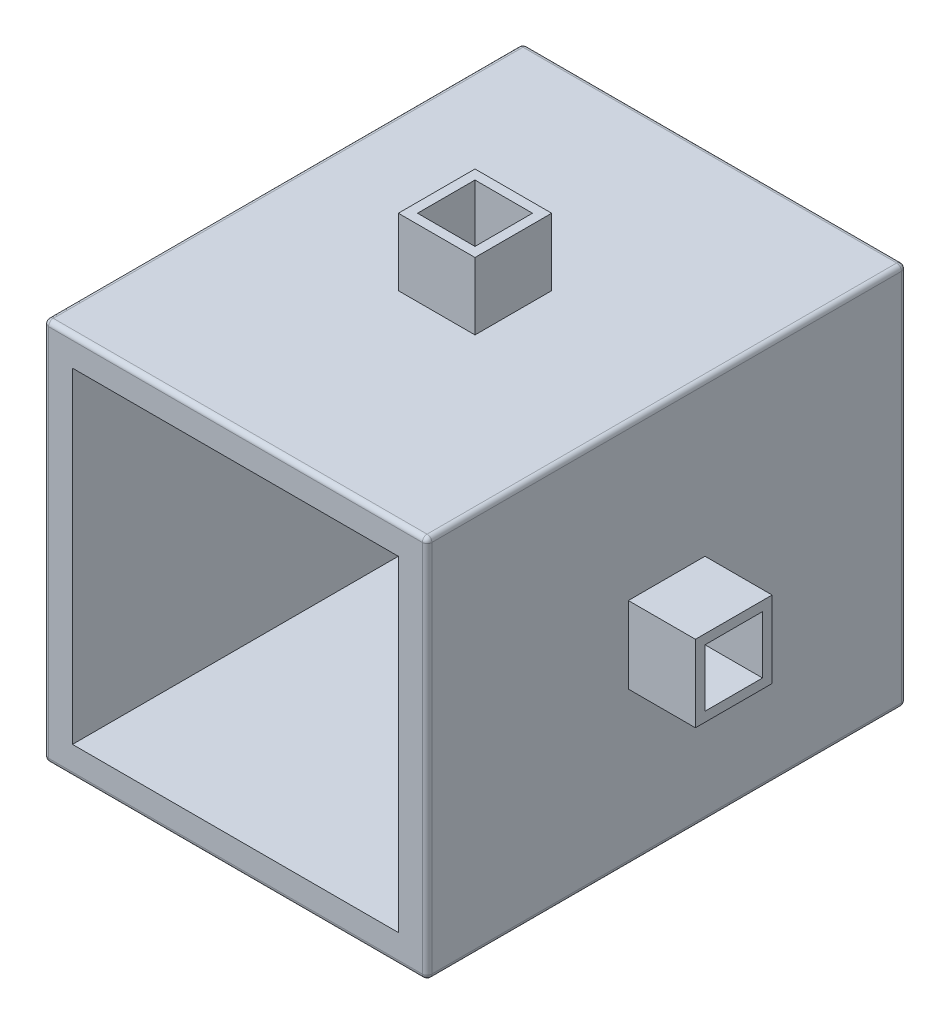
from build123d import *

# Parameters (mm, degrees)
SKETCH1_W           = 101.6
SKETCH1_H           = 101.6
BOSS_EXTRUDE1_DEPTH = 127
SKETCH2_W           = 86.36
SKETCH2_H           = 86.36
CUT_EXTRUDE1_DEPTH  = 116.84
SKETCH4_W           = 20.32
SKETCH4_H           = 20.32
SKETCH4_W_2         = 15.24
SKETCH4_H_2         = 15.24
BOSS_EXTRUDE2_DEPTH = 17.78
SKETCH6_R           = 7.62
CUT_EXTRUDE2_DEPTH  = 1.27
SKETCH7_W           = 20.32
SKETCH7_H           = 20.32
SKETCH7_W_2         = 15.24
SKETCH7_H_2         = 15.24
BOSS_EXTRUDE3_DEPTH = 17.78
SKETCH9_R           = 7.62
CUT_EXTRUDE3_DEPTH  = 1.27
FILLET1_R           = 1.27


with BuildPart() as part:
    # Sketch1 → Boss-Extrude1 (new body)
    with BuildSketch(Plane.XY):
        Rectangle(SKETCH1_W, SKETCH1_H)
    extrude(amount=BOSS_EXTRUDE1_DEPTH)

    # Sketch2 → Cut-Extrude1 (cut)
    with BuildSketch(Plane.XY.offset(127)):
        Rectangle(SKETCH2_W, SKETCH2_H)
    extrude(amount=-CUT_EXTRUDE1_DEPTH, mode=Mode.SUBTRACT)

    # Sketch4 → Boss-Extrude2 (add)
    with BuildSketch(Plane(origin=(0, 50.8, 0), x_dir=(1, 0, 0), z_dir=(0, 1, 0))):
        with Locations((0, -63.5)):
            Rectangle(SKETCH4_W, SKETCH4_H)
        with Locations((0, -63.5)):
            Rectangle(SKETCH4_W_2, SKETCH4_H_2, mode=Mode.SUBTRACT)
    boss_extrude2 = extrude(amount=BOSS_EXTRUDE2_DEPTH)

    # Sketch6 → Cut-Extrude2 (cut)
    with BuildSketch(Plane(origin=(0, 50.8, 0), x_dir=(1, 0, 0), z_dir=(0, 1, 0))):
        with Locations(Location((0, -63.5, 0), (0, 0, 180))):
            Circle(SKETCH6_R)
    cut_extrude2 = extrude(amount=-CUT_EXTRUDE2_DEPTH, mode=Mode.SUBTRACT)

    # Mirror1: Boss-Extrude2, Cut-Extrude2 across plane
    add(boss_extrude2.mirror(Plane.ZX))
    add(cut_extrude2.mirror(Plane.ZX), mode=Mode.SUBTRACT)

    # Sketch7 → Boss-Extrude3 (add)
    with BuildSketch(Plane(origin=(50.8, 0, 0), x_dir=(0, 0, -1), z_dir=(1, 0, 0))):
        with Locations((-63.5, 0)):
            Rectangle(SKETCH7_W, SKETCH7_H)
        with Locations((-63.5, 0)):
            Rectangle(SKETCH7_W_2, SKETCH7_H_2, mode=Mode.SUBTRACT)
    boss_extrude3 = extrude(amount=BOSS_EXTRUDE3_DEPTH)

    # Sketch9 → Cut-Extrude3 (cut)
    with BuildSketch(Plane(origin=(50.8, 0, 0), x_dir=(0, 0, -1), z_dir=(1, 0, 0))):
        with Locations((-63.5, 0)):
            Circle(SKETCH9_R)
    cut_extrude3 = extrude(amount=-CUT_EXTRUDE3_DEPTH, mode=Mode.SUBTRACT)

    # Mirror2: Boss-Extrude3, Cut-Extrude3 across plane
    add(boss_extrude3.mirror(Plane(origin=(0, 0, 0), x_dir=(0, 0, 1), z_dir=(1, 0, 0))))
    add(cut_extrude3.mirror(Plane(origin=(0, 0, 0), x_dir=(0, 0, 1), z_dir=(1, 0, 0))), mode=Mode.SUBTRACT)

    # Fillet1
    fillet1_edges = [part.edges().sort_by_distance(p)[0] for p in [
        (50.8, 0, 127),
        (0, 50.8, 127),
        (-50.8, 0, 127),
        (0, 50.8, 0),
        (50.8, 0, 0),
        (0, -50.8, 0),
        (-50.8, 0, 0),
        (0, -50.8, 127),
        (-50.8, 50.8, 63.5),
        (50.8, 50.8, 63.5),
        (50.8, -50.8, 63.5),
        (-50.8, -50.8, 63.5),
    ]]
    fillet(fillet1_edges, radius=FILLET1_R)


solid = part.part
